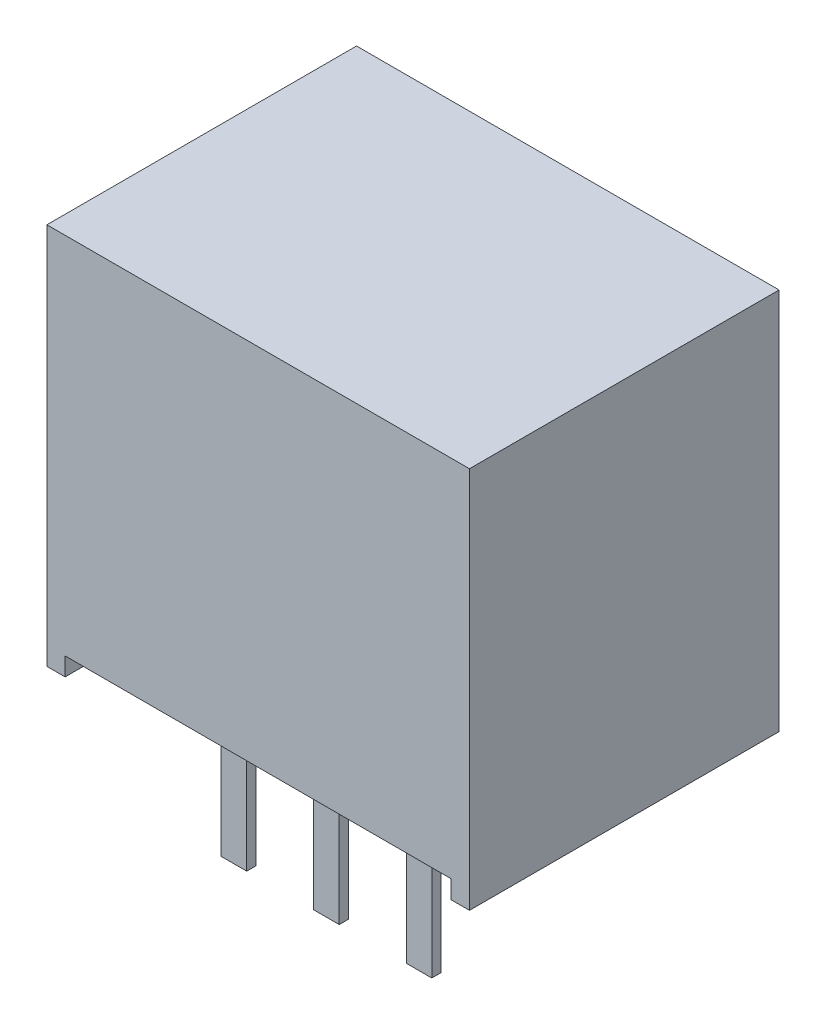
from build123d import *

# Parameters (mm, degrees)
SKETCH1_W           = 11.6
SKETCH1_H           = 10.5
BOSS_EXTRUDE1_DEPTH = 4.25
SKETCH2_W           = 10.6
SKETCH2_H           = 0.5
CUT_EXTRUDE1_DEPTH  = 12.552164299
SKETCH3_W           = 0.7
SKETCH3_H           = 0.25
BOSS_EXTRUDE2_DEPTH = 4.5


with BuildPart() as part:
    # Sketch1 → Boss-Extrude1 (new, symmetric)
    with BuildSketch(Plane.XY):
        Rectangle(SKETCH1_W, SKETCH1_H)
    extrude(amount=BOSS_EXTRUDE1_DEPTH, both=True)

    # Sketch2 → Cut-Extrude1 (cut, through all)
    with BuildSketch(Plane.XY.offset(4.25)):
        with Locations((0, -5)):
            Rectangle(SKETCH2_W, SKETCH2_H)
    extrude(amount=-CUT_EXTRUDE1_DEPTH, mode=Mode.SUBTRACT)

    # Sketch3 → Boss-Extrude2 (add)
    with BuildSketch(Plane(origin=(0, -4.75, 0), x_dir=(-1, 0, 0), z_dir=(0, -1, 0))):
        with Locations((0, -2.25)):
            Rectangle(SKETCH3_W, SKETCH3_H)
        with Locations((2.54, -2.25)):
            Rectangle(SKETCH3_W, SKETCH3_H)
        with Locations((-2.54, -2.25)):
            Rectangle(SKETCH3_W, SKETCH3_H)
    extrude(amount=BOSS_EXTRUDE2_DEPTH)


solid = part.part
